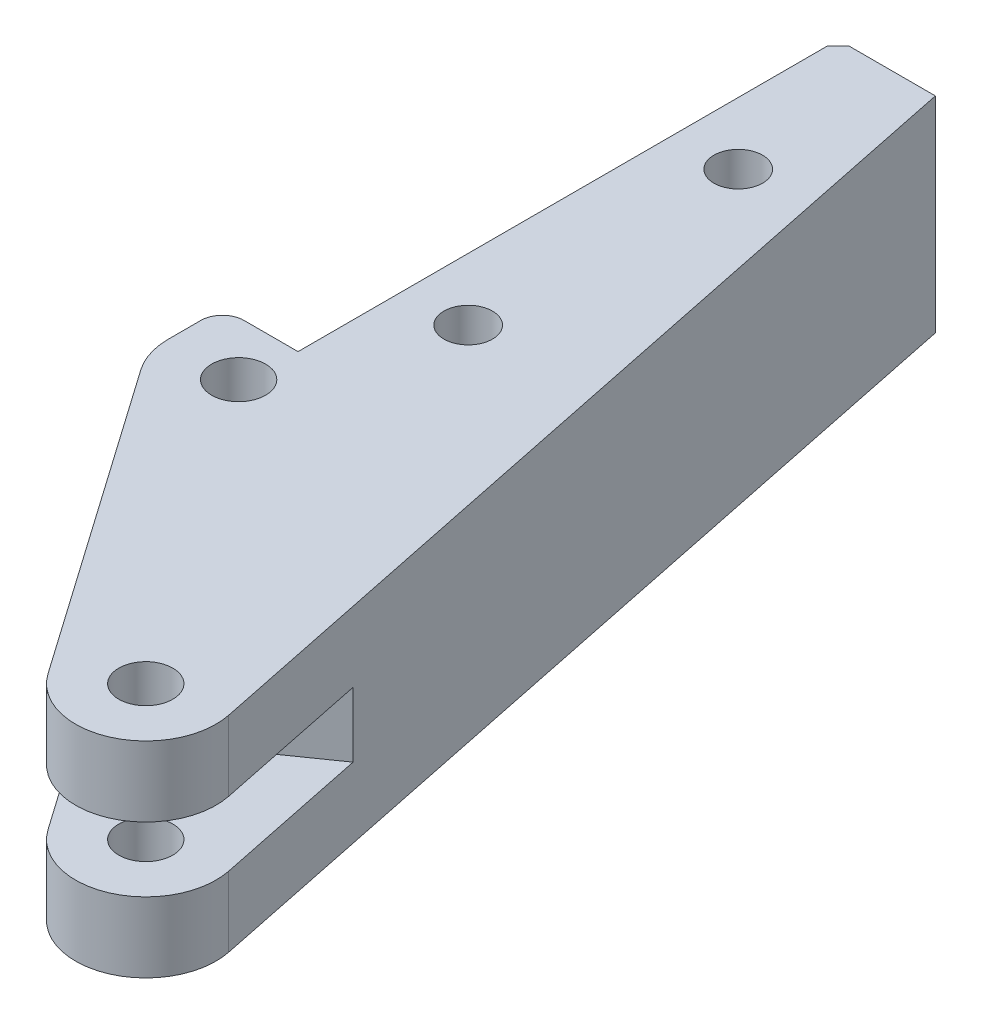
from build123d import *

# Parameters (mm, degrees)
BOSS_EXTRU_2_DEPTH      = 19
ESQUISSE3_R             = 2.5
ENL_V_MAT_EXTRU_1_DEPTH = 81.564305533
ENL_V_MAT_EXTRU_2_DEPTH = 3
CHANFREIN1_SIZE         = 4
ESQUISSE7_W             = 7
ESQUISSE7_H             = 50
ENL_V_MAT_EXTRU_4_DEPTH = 19
BOSS_EXTRU_3_REACH      = 82.564
ENL_V_START             = 6
ENL_V_MAT_EXTRU_7_DEPTH = 6
CONG_2_R                = 2
CHANFREIN2_SIZE         = 1
ESQUISSE9_R             = 2.25
ENL_V_MAT_EXTRU_5_DEPTH = 81.564305533


with BuildPart() as part:
    # Esquisse1 → Boss.-Extru.2 (new body)
    with BuildSketch(Plane(origin=(0, 20, 0), x_dir=(1, 0, 0), z_dir=(0, 1, 0))):
        with BuildLine():
            Line((25.673562069, 38.419058892), (25.673562069, -16.580941108))
            ThreePointArc((25.673562069, -16.580941108), (25.974401889, -18.535528805), (26.849073781, -20.309187945))
            Line((26.849073781, -20.309187945), (46.924249054, -48.979509495))
            ThreePointArc((46.924249054, -48.979509495), (55.976984178, -50.575750946), (57.573225629, -41.523015822))
            Line((57.573225629, -41.523015822), (39.758649804, -16.081164865))
            ThreePointArc((39.758649804, -16.081164865), (38.951260365, -14.443941044), (38.673562069, -12.639706247))
            Line((38.673562069, -12.639706247), (38.673562069, 38.419058892))
            Line((38.673562069, 38.419058892), (25.673562069, 38.419058892))
        make_face()
    extrude(amount=BOSS_EXTRU_2_DEPTH)

    # Esquisse3 → Enlèv. mat.-Extru.1 (cut, through all)
    with BuildSketch(Plane(origin=(0, 39, 0), x_dir=(1, 0, 0), z_dir=(0, 1, 0))):
        with Locations(Location((32.173562069, -16.580941108, 0), (0, 0, 270))):
            Circle(ESQUISSE3_R)
        with Locations(Location((52.248737342, -45.251262658, 0), (0, 0, 270))):
            Circle(ESQUISSE3_R)
    extrude(amount=-ENL_V_MAT_EXTRU_1_DEPTH, mode=Mode.SUBTRACT)

    # Esquisse4 → Enlèv. mat.-Extru.2 (cut, symmetric)
    with BuildSketch(Plane(origin=(0, 29.5, 0), x_dir=(1, 0, 0), z_dir=(0, 1, 0))):
        with BuildLine():
            Line((57.573225629, -41.523015822), (51.26388483, -32.512343335))
            Line((51.26388483, -32.512343335), (40.614908254, -39.968837008))
            Line((40.614908254, -39.968837008), (46.924249054, -48.979509495))
            ThreePointArc((46.924249054, -48.979509495), (55.976984178, -50.575750946), (57.573225629, -41.523015822))
        make_face()
    extrude(amount=ENL_V_MAT_EXTRU_2_DEPTH, both=True, mode=Mode.SUBTRACT)

    # Chanfrein1
    chanfrein1_edges = [part.edges().sort_by_distance(p)[0] for p in [
        (40.614908254, 29.5, 39.968837008),
    ]]
    chamfer(chanfrein1_edges, length=CHANFREIN1_SIZE)

    # Esquisse7 → Enlèv. mat.-Extru.4 (cut)
    with BuildSketch(Plane(origin=(0, 39, 0), x_dir=(1, 0, 0), z_dir=(0, 1, 0))):
        with Locations((29.173562069, 13.419058892)):
            Rectangle(ESQUISSE7_W, ESQUISSE7_H)
    extrude(amount=-ENL_V_MAT_EXTRU_4_DEPTH, mode=Mode.SUBTRACT)

    # Boss.-Extru.3: up to this face of the body (flat: up to its plane)
    boss_extru_3_end = Plane(part.part.faces().sort_by_distance((29.173562069, 20, 12.541391737))[0])
    # Esquisse8 → Boss.-Extru.3 (add, up to the picked face)
    with BuildSketch(Plane(origin=(0, 39, 0), x_dir=(1, 0, 0), z_dir=(0, 1, 0)), mode=Mode.PRIVATE) as boss_extru_3_sk1:
        with BuildLine():
            Line((38.673562069, 38.419058892), (41.673562069, 38.419058892))
            Line((41.673562069, 38.419058892), (58.615433045, -43.941611626))
            Line((58.615433045, -43.941611626), (57.573225629, -43.941611626))
            Line((57.573225629, -43.941611626), (57.573225629, -41.523015822))
            Line((57.573225629, -41.523015822), (39.758649804, -16.081164865))
            ThreePointArc((39.758649804, -16.081164865), (38.951260365, -14.443941044), (38.673562069, -12.639706247))
            Line((38.673562069, -12.639706247), (38.673562069, 38.419058892))
        make_face()
    boss_extru_3_tool1 = split(extrude(boss_extru_3_sk1.sketch, amount=-BOSS_EXTRU_3_REACH, mode=Mode.PRIVATE), bisect_by=boss_extru_3_end, keep=Keep.BOTH, mode=Mode.PRIVATE)
    add(boss_extru_3_tool1.solids().sort_by(Axis((45.454981, 39, 2.99996), (0, -1, 0)))[0])

    # Esquisse11 → Enlèv. mat.-Extru.7 (cut)
    with BuildSketch(Plane.XZ.offset(-32.5).offset(ENL_V_START)):
        with BuildLine():
            Line((51.26388483, 32.512343335), (43.891516431, 37.674531262))
            Line((43.891516431, 37.674531262), (38.320602508, 36.69222883))
            Line((38.320602508, 36.69222883), (46.924249054, 48.979509495))
            ThreePointArc((46.924249054, 48.979509495), (54.821022864, 51.220630062), (58.615433045, 43.941611626))
            Line((58.615433045, 43.941611626), (55.634824859, 29.451778178))
            Line((55.634824859, 29.451778178), (51.26388483, 32.512343335))
        make_face()
    extrude(amount=-ENL_V_MAT_EXTRU_7_DEPTH, mode=Mode.SUBTRACT)

    # Congé2
    cong_2_edges = [part.edges().sort_by_distance(p)[0] for p in [
        (25.673562069, 29.5, 11.580941108),
    ]]
    fillet(cong_2_edges, radius=CONG_2_R)

    # Chanfrein2
    chanfrein2_edges = [part.edges().sort_by_distance(p)[0] for p in [
        (32.673562069, 29.5, -38.419058892),
    ]]
    chamfer(chanfrein2_edges, length=CHANFREIN2_SIZE)

    # Esquisse9 → Enlèv. mat.-Extru.5 (cut, through all)
    with BuildSketch(Plane(origin=(0, 39, 0), x_dir=(1, 0, 0), z_dir=(0, 1, 0))):
        with Locations(Location((38.423562069, 23.419058892, 0), (0, 0, 270))):
            Circle(ESQUISSE9_R)
        with Locations(Location((38.423562069, -1.580941108, 0), (0, 0, 270))):
            Circle(ESQUISSE9_R)
    extrude(amount=-ENL_V_MAT_EXTRU_5_DEPTH, mode=Mode.SUBTRACT)


solid = part.part
